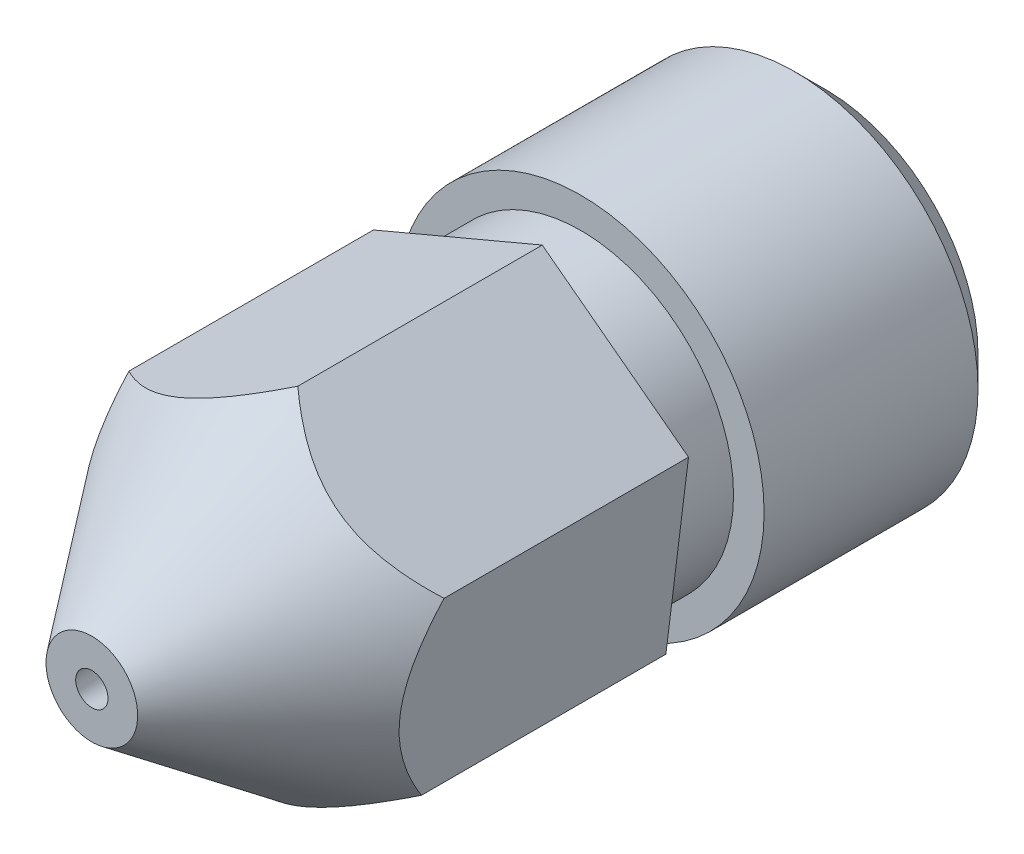
from build123d import *

# Parameters (mm, degrees)
CROQUIS8_W            = 2.174939389
CROQUIS8_H            = 2.19283881
CORTAR_EXTRUIR2_DEPTH = 10
CROQUIS11_R           = 1
CORTAR_EXTRUIR3_DEPTH = 9.185352772
CORTAR_EXTRUIR3_TAPER = 6
CROQUIS13_OUTSIDE_W   = 10.94
CROQUIS13_OUTSIDE_H   = 10.94
CORTAR_EXTRUIR4_DEPTH = 10


with BuildPart() as part:
    # Croquis1 → Revolución1 (revolve)
    with BuildSketch(Plane(origin=(0, 0, 0), x_dir=(1, 0, 0), z_dir=(0, 1, 0))):
        Polygon((2.5, 5), (0, 5), (0, 0), (2.5, 0), (2.5, 1), (3, 1), (3, 4.5), align=None)
    revolve(axis=Axis((0, 0, -5), (0, 0, 1)))

    # Croquis2 → Cortar-Revolución1 (revolve, cut)
    with BuildSketch(Plane(origin=(0, 0, 0), x_dir=(1, 0, 0), z_dir=(0, 1, 0))):
        Polygon((1.5, 5), (0, 5), (0, -8), (0.2, -8), (0.2, -7.2), (1, -6.4), (1, 4.5), align=None)
    revolve(axis=Axis((0, 0, -5), (0, 0, 1)), mode=Mode.SUBTRACT)

    # Croquis4 → Revolución2 (revolve)
    with BuildSketch(Plane(origin=(0, 0, 0), x_dir=(1, 0, 0), z_dir=(0, 1, 0)), mode=Mode.PRIVATE) as revoluci_n2_sk:
        Polygon((0, 0), (0, -8), (3, -4), (3, 0), align=None)
    revolve(revoluci_n2_sk.sketch.rotate(Axis((0, 0, 0), (0, 0, 1)), 180), axis=Axis((0, 0, 0), (0, 0, 1)))

    # Croquis8 → Cortar-Extruir2 (cut)
    with BuildSketch(Plane.XY.offset(7)):
        with Locations((-0.052168773, -0.007828758)):
            Rectangle(CROQUIS8_W, CROQUIS8_H)
    extrude(amount=CORTAR_EXTRUIR2_DEPTH, mode=Mode.SUBTRACT)

    # Croquis11 → Cortar-Extruir3 (cut, through all)
    with BuildSketch(Plane.XY):
        Circle(CROQUIS11_R)
    extrude(amount=CORTAR_EXTRUIR3_DEPTH, taper=CORTAR_EXTRUIR3_TAPER, mode=Mode.SUBTRACT)

    # Croquis13 outside → Cortar-Extruir4 (cut)
    with BuildSketch(Plane.XY):
        Rectangle(CROQUIS13_OUTSIDE_W, CROQUIS13_OUTSIDE_H)
        Polygon((2.763390844, 1.167763265), (0.370382769, 2.977048304), (-2.393008075, 1.809285039), (-2.763390844, -1.167763265), (-0.370382769, -2.977048304), (2.393008075, -1.809285039), align=None, mode=Mode.SUBTRACT)
    extrude(amount=CORTAR_EXTRUIR4_DEPTH, mode=Mode.SUBTRACT)


solid = part.part
